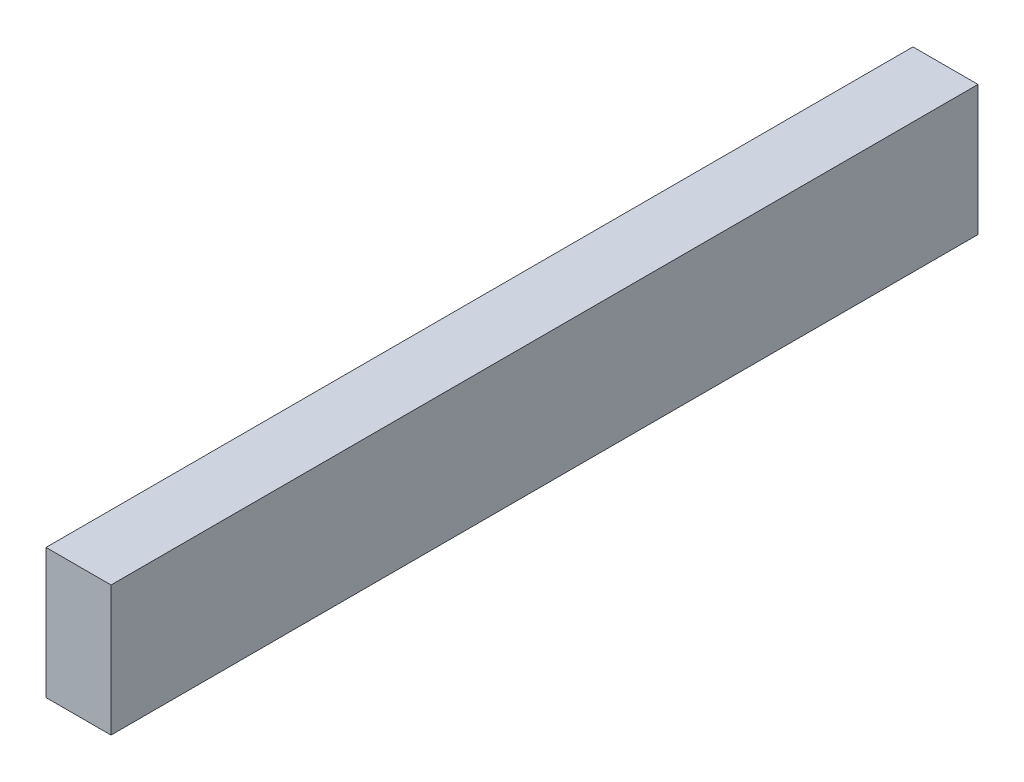
from build123d import *

# Parameters (mm, degrees)
SKETCH1_W           = 30
SKETCH1_H           = 60
BOSS_EXTRUDE1_DEPTH = 200


with BuildPart() as part:
    # Sketch1 → Boss-Extrude1 (new, symmetric)
    with BuildSketch(Plane.XY):
        Rectangle(SKETCH1_W, SKETCH1_H)
    extrude(amount=BOSS_EXTRUDE1_DEPTH, both=True)


solid = part.part
